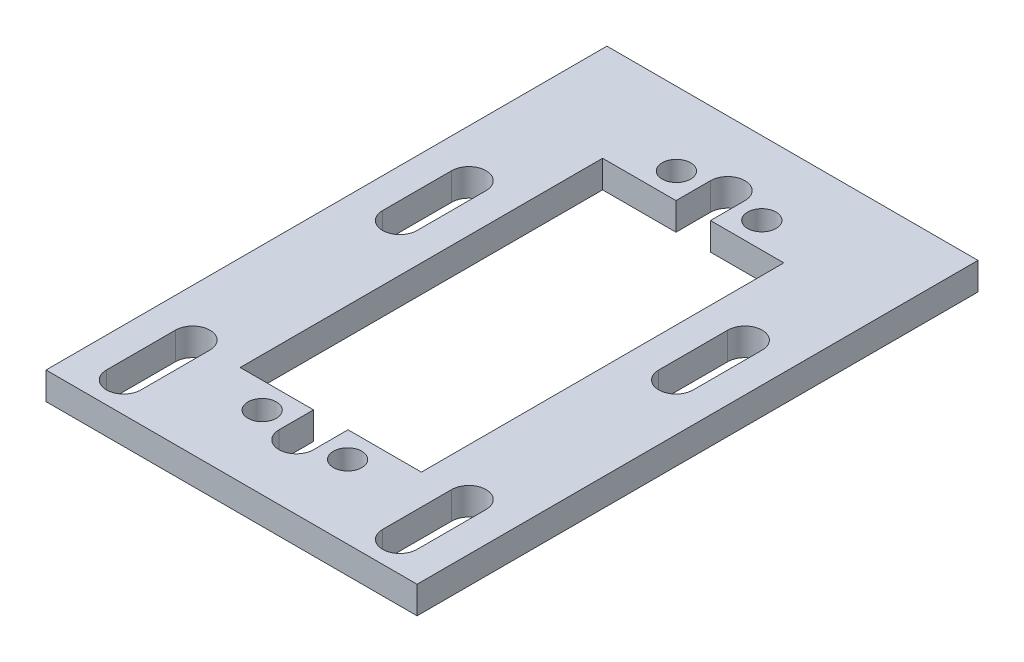
from build123d import *

# Parameters (mm, degrees)
SKETCH1_W           = 43
SKETCH1_H           = 65
SKETCH1_R           = 1.65
BOSS_EXTRUDE1_DEPTH = 3.175
CUT_EXTRUDE1_DEPTH  = 3.175


with BuildPart() as part:
    # Sketch1 → Boss-Extrude1 (new body)
    with BuildSketch(Plane(origin=(0, 0, 0), x_dir=(1, 0, 0), z_dir=(0, 1, 0))):
        Rectangle(SKETCH1_W, SKETCH1_H)
        with Locations(Location((-4.95, -24, 0), (0, 0, 270))):
            Circle(SKETCH1_R, mode=Mode.SUBTRACT)
        with BuildLine():
            Line((-10.5, 21), (-2, 21))
            Line((-2, 21), (-2, 24))
            Line((-2, 24), (-2, 25))
            ThreePointArc((-2, 25), (0, 27), (2, 25))
            Line((2, 25), (2, 24))
            Line((2, 24), (2, 21))
            Line((2, 21), (10.5, 21))
            Line((10.5, 21), (10.5, 0))
            Line((10.5, 0), (10.5, -21))
            Line((10.5, -21), (2, -21))
            Line((2, -21), (2, -24))
            Line((2, -24), (2, -25))
            ThreePointArc((2, -25), (0, -27), (-2, -25))
            Line((-2, -25), (-2, -24))
            Line((-2, -24), (-2, -21))
            Line((-2, -21), (-10.5, -21))
            Line((-10.5, -21), (-10.5, 0))
            Line((-10.5, 0), (-10.5, 21))
        make_face(mode=Mode.SUBTRACT)
        with BuildLine():
            ThreePointArc((6.6, -24), (4.95, -25.65), (3.3, -24))
            ThreePointArc((3.3, -24), (4.95, -22.35), (6.6, -24))
        make_face(mode=Mode.SUBTRACT)
        with Locations(Location((-4.95, 24, 0), (0, 0, 270))):
            Circle(SKETCH1_R, mode=Mode.SUBTRACT)
        with BuildLine():
            ThreePointArc((6.6, 24), (4.95, 22.35), (3.3, 24))
            ThreePointArc((3.3, 24), (4.95, 25.65), (6.6, 24))
        make_face(mode=Mode.SUBTRACT)
    extrude(amount=BOSS_EXTRUDE1_DEPTH)

    # Sketch3 → Cut-Extrude1 (cut)
    with BuildSketch(Plane(origin=(0, 3.175, 0), x_dir=(1, 0, 0), z_dir=(0, 1, 0))):
        with BuildLine():
            Line((-14, -21), (-14, -29))
            ThreePointArc((-14, -29), (-16, -31), (-18, -29))
            Line((-18, -29), (-18, -21))
            ThreePointArc((-18, -21), (-16, -19), (-14, -21))
        make_face()
        with BuildLine():
            Line((14, -21), (14, -29))
            ThreePointArc((14, -29), (16, -31), (18, -29))
            Line((18, -29), (18, -21))
            ThreePointArc((18, -21), (16, -19), (14, -21))
        make_face()
        with BuildLine():
            Line((-14, 11), (-14, 3))
            ThreePointArc((-14, 3), (-16, 1), (-18, 3))
            Line((-18, 3), (-18, 11))
            ThreePointArc((-18, 11), (-16, 13), (-14, 11))
        make_face()
        with BuildLine():
            Line((14, 11), (14, 3))
            ThreePointArc((14, 3), (16, 1), (18, 3))
            Line((18, 3), (18, 11))
            ThreePointArc((18, 11), (16, 13), (14, 11))
        make_face()
    extrude(amount=-CUT_EXTRUDE1_DEPTH, mode=Mode.SUBTRACT)


solid = part.part
